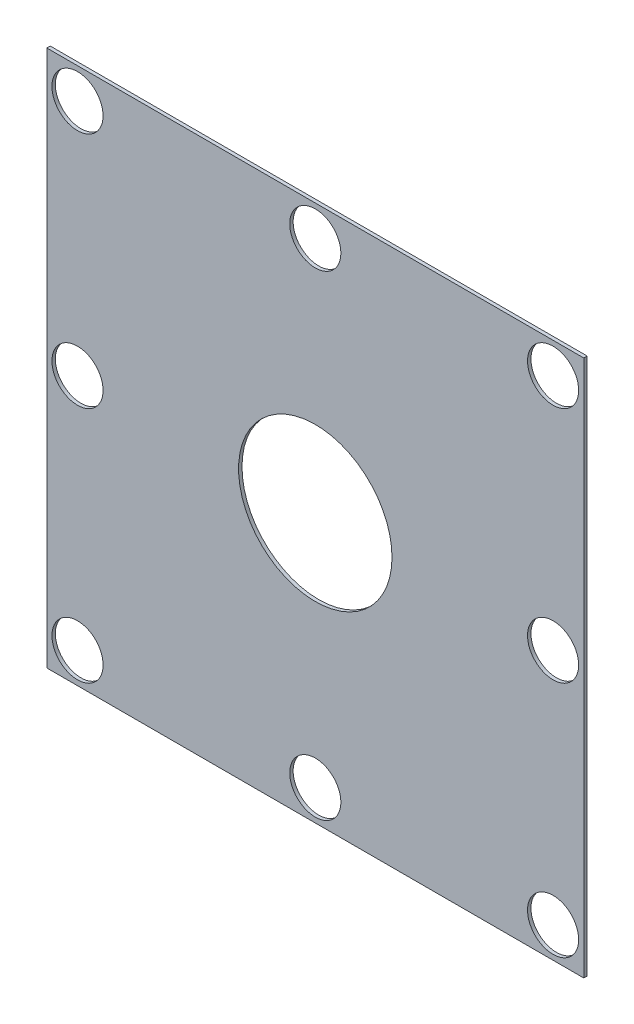
from build123d import *

# Parameters (mm, degrees)
SKETCH_1_W          = 31.5
SKETCH_1_H          = 31.5
EXTRUDE_1_DEPTH     = 0.2
SKETCH_2_R          = 4.5
CUT_EXTRUDE_1_DEPTH = 10
SKETCH_3_R          = 1.5
SKETCH_3_R_2        = 4.5
CUT_EXTRUDE_2_DEPTH = 0.2


with BuildPart() as part:
    # 스케치1 → 보스-돌출1 (new body)
    with BuildSketch(Plane.XY):
        with Locations((15.75, 15.75)):
            Rectangle(SKETCH_1_W, SKETCH_1_H)
    extrude(amount=EXTRUDE_1_DEPTH)

    # 스케치2 → 컷-돌출1 (cut)
    with BuildSketch(Plane.XY.offset(0.2)):
        with Locations((15.75, 15.75)):
            Circle(SKETCH_2_R)
    extrude(amount=-CUT_EXTRUDE_1_DEPTH, mode=Mode.SUBTRACT)

    # 스케치3 → 컷-돌출2 (cut)
    with BuildSketch(Plane.XY.offset(0.2)):
        with Locations((29.7, 15.75)):
            Circle(SKETCH_3_R)
        with Locations((15.75, 15.75)):
            Circle(SKETCH_3_R_2)
        with Locations((15.75, 1.8)):
            Circle(SKETCH_3_R)
        with Locations((1.8, 15.75)):
            Circle(SKETCH_3_R)
        with Locations((15.75, 29.7)):
            Circle(SKETCH_3_R)
        with Locations((1.8, 29.7)):
            Circle(SKETCH_3_R)
        with Locations((29.7, 29.7)):
            Circle(SKETCH_3_R)
        with Locations((29.7, 1.8)):
            Circle(SKETCH_3_R)
        with Locations((1.8, 1.8)):
            Circle(SKETCH_3_R)
    extrude(amount=-CUT_EXTRUDE_2_DEPTH, mode=Mode.SUBTRACT)


solid = part.part
